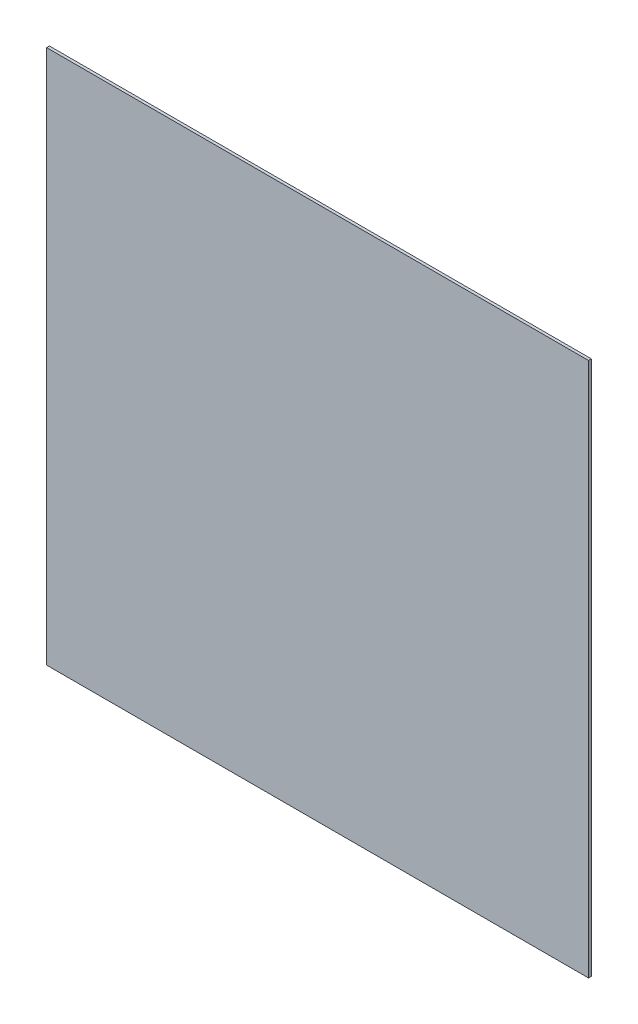
from build123d import *

# Parameters (mm, degrees)
SKETCH1_W           = 770
SKETCH1_H           = 760
BOSS_EXTRUDE1_DEPTH = 4


with BuildPart() as part:
    # Sketch1 → Boss-Extrude1 (new body)
    with BuildSketch(Plane.XY):
        Rectangle(SKETCH1_W, SKETCH1_H)
    extrude(amount=BOSS_EXTRUDE1_DEPTH)


solid = part.part
